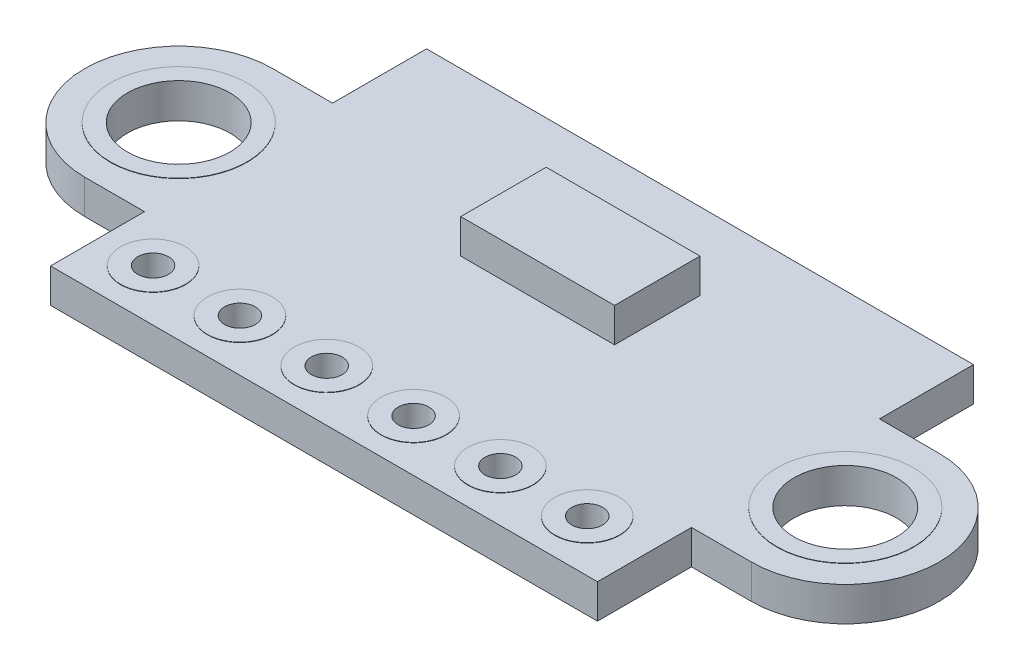
from build123d import *

# Parameters (mm, degrees)
SKETCH_1_R      = 1.5
SKETCH_1_R_2    = 0.45
EXTRUDE_1_DEPTH = 1
EXTRUDE_START   = -0.01
SKETCH_1_3_R    = 2
SKETCH_1_3_R_2  = 1.5
SKETCH_1_3_R_3  = 0.95
SKETCH_1_3_R_4  = 0.45
EXTRUDE_2_DEPTH = 1.02
SKETCH_2_W      = 4.5
SKETCH_2_H      = 2.5
EXTRUDE_3_DEPTH = 1
SKETCH_3_W      = 1.6
SKETCH_3_H      = 0.85
SKETCH_3_W_2    = 0.85
SKETCH_3_H_2    = 1.6
EXTRUDE_4_DEPTH = 0.8
SKETCH_3_3_W    = 0.85
SKETCH_3_3_H    = 1.6
SKETCH_3_3_W_2  = 1.8
SKETCH_3_3_H_2  = 3
EXTRUDE_5_DEPTH = 0.5
SKETCH_3_4_W    = 3
SKETCH_3_4_H    = 1.5
SKETCH_3_4_W_2  = 2
SKETCH_3_4_H_2  = 1.2
EXTRUDE_6_DEPTH = 1


with BuildPart() as part:
    # Эскиз1 → Бобышка-Вытянуть1 (new body)
    with BuildSketch(Plane(origin=(0, 0, 0), x_dir=(1, 0, 0), z_dir=(0, 1, 0))):
        with BuildLine():
            Line((8, -5.5), (-8, -5.5))
            Line((-8, -5.5), (-8, -2.75))
            Line((-8, -2.75), (-9.75, -2.75))
            ThreePointArc((-9.75, -2.75), (-12.5, 0), (-9.75, 2.75))
            Line((-9.75, 2.75), (-8, 2.75))
            Line((-8, 2.75), (-8, 5.5))
            Line((-8, 5.5), (8, 5.5))
            Line((8, 5.5), (8, 2.75))
            Line((8, 2.75), (9.75, 2.75))
            ThreePointArc((9.75, 2.75), (12.5, 0), (9.75, -2.75))
            Line((9.75, -2.75), (8, -2.75))
            Line((8, -2.75), (8, -5.5))
        make_face()
        with Locations(Location((-9.75, 0, 0), (0, 0, 270))):
            Circle(SKETCH_1_R, mode=Mode.SUBTRACT)
        with Locations(Location((9.75, 0, 0), (0, 0, 270))):
            Circle(SKETCH_1_R, mode=Mode.SUBTRACT)
        with Locations(Location((-6.5, -4, 0), (0, 0, 270))):
            Circle(SKETCH_1_R_2, mode=Mode.SUBTRACT)
        with Locations(Location((-3.96, -4, 0), (0, 0, 270))):
            Circle(SKETCH_1_R_2, mode=Mode.SUBTRACT)
        with Locations(Location((-1.42, -4, 0), (0, 0, 270))):
            Circle(SKETCH_1_R_2, mode=Mode.SUBTRACT)
        with Locations(Location((1.12, -4, 0), (0, 0, 270))):
            Circle(SKETCH_1_R_2, mode=Mode.SUBTRACT)
        with Locations(Location((3.66, -4, 0), (0, 0, 270))):
            Circle(SKETCH_1_R_2, mode=Mode.SUBTRACT)
        with Locations(Location((6.2, -4, 0), (0, 0, 270))):
            Circle(SKETCH_1_R_2, mode=Mode.SUBTRACT)
    extrude(amount=EXTRUDE_1_DEPTH)

    # Эскиз1<3> → Бобышка-Вытянуть2 (add)
    # profile 1 of 8: a face of its own
    with BuildSketch(Plane(origin=(0, 0, 0), x_dir=(1, 0, 0), z_dir=(0, 1, 0)).offset(EXTRUDE_START)):
        with Locations(Location((-9.75, 0, 0), (0, 0, 270))):
            Circle(SKETCH_1_3_R)
        with Locations(Location((-9.75, 0, 0), (0, 0, 270))):
            Circle(SKETCH_1_3_R_2, mode=Mode.SUBTRACT)
    # profile 2 of 8: a face of its own
    with BuildSketch(Plane(origin=(0, 0, 0), x_dir=(1, 0, 0), z_dir=(0, 1, 0)).offset(EXTRUDE_START)):
        with Locations(Location((-6.5, -4, 0), (0, 0, 270))):
            Circle(SKETCH_1_3_R_3)
        with Locations(Location((-6.5, -4, 0), (0, 0, 270))):
            Circle(SKETCH_1_3_R_4, mode=Mode.SUBTRACT)
    # profile 3 of 8: a face of its own
    with BuildSketch(Plane(origin=(0, 0, 0), x_dir=(1, 0, 0), z_dir=(0, 1, 0)).offset(EXTRUDE_START)):
        with Locations(Location((-3.96, -4, 0), (0, 0, 270))):
            Circle(SKETCH_1_3_R_3)
        with Locations(Location((-3.96, -4, 0), (0, 0, 270))):
            Circle(SKETCH_1_3_R_4, mode=Mode.SUBTRACT)
    # profile 4 of 8: a face of its own
    with BuildSketch(Plane(origin=(0, 0, 0), x_dir=(1, 0, 0), z_dir=(0, 1, 0)).offset(EXTRUDE_START)):
        with Locations(Location((-1.42, -4, 0), (0, 0, 270))):
            Circle(SKETCH_1_3_R_3)
        with Locations(Location((-1.42, -4, 0), (0, 0, 270))):
            Circle(SKETCH_1_3_R_4, mode=Mode.SUBTRACT)
    # profile 5 of 8: a face of its own
    with BuildSketch(Plane(origin=(0, 0, 0), x_dir=(1, 0, 0), z_dir=(0, 1, 0)).offset(EXTRUDE_START)):
        with Locations(Location((1.12, -4, 0), (0, 0, 270))):
            Circle(SKETCH_1_3_R_3)
        with Locations(Location((1.12, -4, 0), (0, 0, 270))):
            Circle(SKETCH_1_3_R_4, mode=Mode.SUBTRACT)
    # profile 6 of 8: a face of its own
    with BuildSketch(Plane(origin=(0, 0, 0), x_dir=(1, 0, 0), z_dir=(0, 1, 0)).offset(EXTRUDE_START)):
        with Locations(Location((3.66, -4, 0), (0, 0, 270))):
            Circle(SKETCH_1_3_R_3)
        with Locations(Location((3.66, -4, 0), (0, 0, 270))):
            Circle(SKETCH_1_3_R_4, mode=Mode.SUBTRACT)
    # profile 7 of 8: a face of its own
    with BuildSketch(Plane(origin=(0, 0, 0), x_dir=(1, 0, 0), z_dir=(0, 1, 0)).offset(EXTRUDE_START)):
        with Locations(Location((6.2, -4, 0), (0, 0, 270))):
            Circle(SKETCH_1_3_R_3)
        with Locations(Location((6.2, -4, 0), (0, 0, 270))):
            Circle(SKETCH_1_3_R_4, mode=Mode.SUBTRACT)
    # profile 8 of 8: a face of its own
    with BuildSketch(Plane(origin=(0, 0, 0), x_dir=(1, 0, 0), z_dir=(0, 1, 0)).offset(EXTRUDE_START)):
        with Locations(Location((9.75, 0, 0), (0, 0, 270))):
            Circle(SKETCH_1_3_R)
        with Locations(Location((9.75, 0, 0), (0, 0, 270))):
            Circle(SKETCH_1_3_R_2, mode=Mode.SUBTRACT)
    extrude(amount=EXTRUDE_2_DEPTH)

    # Эскиз2 → Бобышка-Вытянуть3 (add)
    with BuildSketch(Plane(origin=(0, 1, 0), x_dir=(1, 0, 0), z_dir=(0, 1, 0))):
        with Locations((0, 2)):
            Rectangle(SKETCH_2_W, SKETCH_2_H)
    extrude(amount=EXTRUDE_3_DEPTH)

    # Эскиз3 → Бобышка-Вытянуть4 (add)
    with BuildSketch(Plane.XZ):
        with Locations((-5.2, 1.875)):
            Rectangle(SKETCH_3_W, SKETCH_3_H)
        with Locations((-1.69, -3.7)):
            Rectangle(SKETCH_3_W_2, SKETCH_3_H_2)
        with Locations((0, -3.7)):
            Rectangle(SKETCH_3_W_2, SKETCH_3_H_2)
        with Locations((1.69, -3.7)):
            Rectangle(SKETCH_3_W_2, SKETCH_3_H_2)
    extrude(amount=EXTRUDE_4_DEPTH)

    # Эскиз3<3> → Бобышка-Вытянуть5 (add)
    with BuildSketch(Plane.XZ):
        with Locations((6.575, -0.7)):
            Rectangle(SKETCH_3_3_W, SKETCH_3_3_H)
        with Locations((5.075, -0.7)):
            Rectangle(SKETCH_3_3_W, SKETCH_3_3_H)
        with Locations((-2.1, 1)):
            Rectangle(SKETCH_3_3_W_2, SKETCH_3_3_H_2)
    extrude(amount=EXTRUDE_5_DEPTH)

    # Эскиз3<4> → Бобышка-Вытянуть6 (add)
    with BuildSketch(Plane.XZ):
        with Locations((-5.5, -1.25)):
            Rectangle(SKETCH_3_4_W, SKETCH_3_4_H)
        with Locations((1.5, 0.9)):
            Rectangle(SKETCH_3_4_W_2, SKETCH_3_4_H_2)
    extrude(amount=EXTRUDE_6_DEPTH)


solid = part.part
